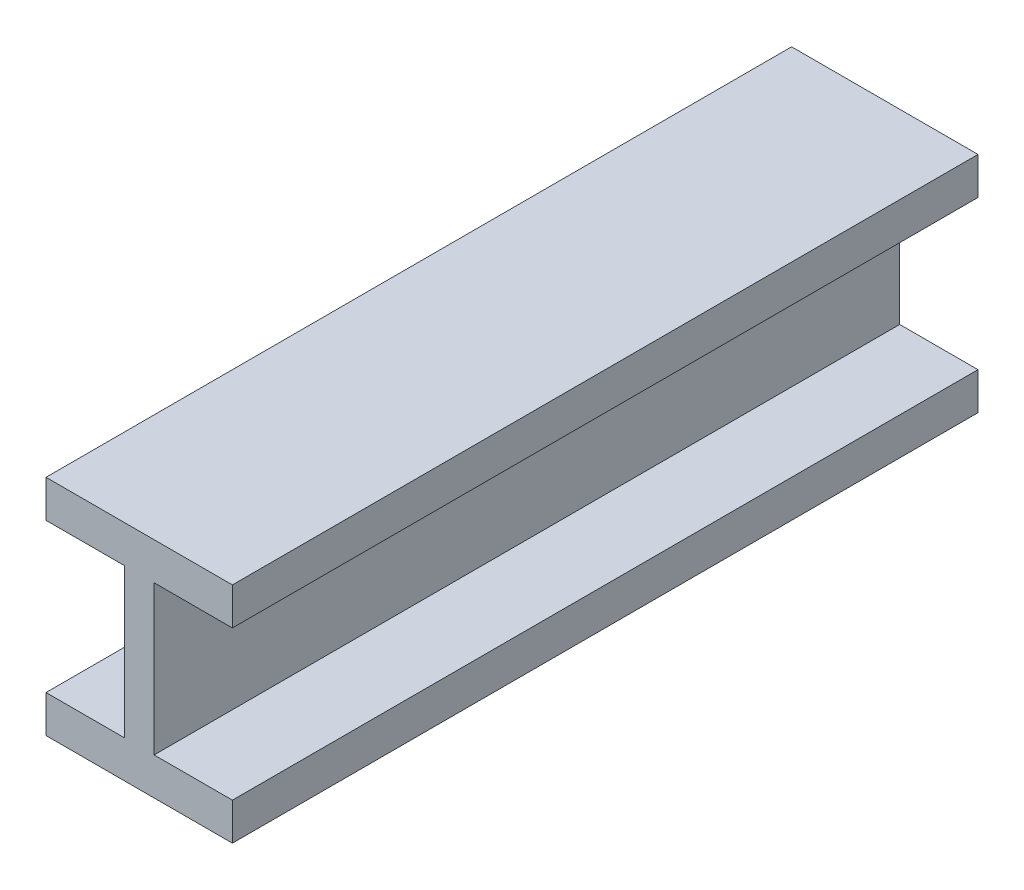
from build123d import *

# Parameters (mm, degrees)
SKETCH1_W           = 4
SKETCH1_H           = 20
BOSS_EXTRUDE1_DEPTH = 100


with BuildPart() as part:
    # Sketch1 → Boss-Extrude1 (new body)
    with BuildSketch(Plane.XY):
        Polygon((-12.5, 15), (-12.5, 10), (-2, 10), (2, 10), (12.5, 10), (12.5, 15), align=None)
        Rectangle(SKETCH1_W, SKETCH1_H)
        Polygon((-12.5, -10), (-12.5, -15), (12.5, -15), (12.5, -10), (2, -10), (-2, -10), align=None)
    extrude(amount=-BOSS_EXTRUDE1_DEPTH)


solid = part.part
